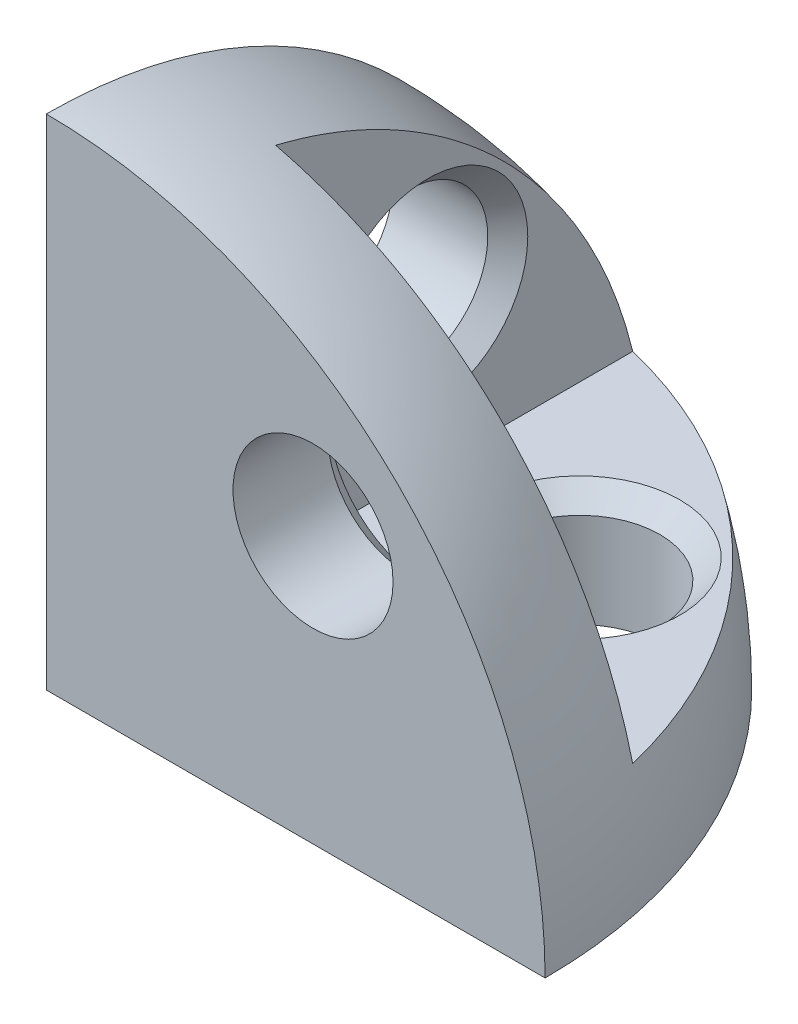
from build123d import *

# Parameters (mm, degrees)
REVOLVE_1_ANGLE     = 90
SHELL_3_T           = -4.3
SKETCH_1_3_R        = 3
CUT_EXTRUDE_2_DEPTH = 10
SKETCH_3_R          = 3
CUT_EXTRUDE_3_DEPTH = 10
SKETCH_4_R          = 3
CUT_EXTRUDE_4_DEPTH = 10
CHAMFER_1_SIZE      = 0.75


with BuildPart() as part:
    # 草图1 → 旋转1 (revolve)
    with BuildSketch(Plane.XY):
        with BuildLine():
            Line((0, 18.7), (0, 0))
            Line((0, 0), (18.7, 0))
            ThreePointArc((18.7, 0), (13.222896808, 13.222896808), (0, 18.7))
        make_face()
    revolve(axis=Axis((0, 0, 0), (0, 1, 0)), revolution_arc=REVOLVE_1_ANGLE)

    # 抽壳3
    shell_3_openings = [part.faces().sort_by_distance(p)[0] for p in [
        (9.35, 13.222896808, -9.35),
    ]]
    offset(amount=SHELL_3_T, openings=shell_3_openings, kind=Kind.INTERSECTION)

    # 草图1<3> → 切除-拉伸2 (cut)
    with BuildSketch(Plane.XY):
        with Locations((10, 10)):
            Circle(SKETCH_1_3_R)
    extrude(amount=-CUT_EXTRUDE_2_DEPTH, mode=Mode.SUBTRACT)

    # 草图3 → 切除-拉伸3 (cut)
    with BuildSketch(Plane.XZ):
        with Locations((10, -10)):
            Circle(SKETCH_3_R)
    extrude(amount=-CUT_EXTRUDE_3_DEPTH, mode=Mode.SUBTRACT)

    # 草图4 → 切除-拉伸4 (cut)
    with BuildSketch(Plane.ZY):
        with Locations((-10, 10)):
            Circle(SKETCH_4_R)
    extrude(amount=-CUT_EXTRUDE_4_DEPTH, mode=Mode.SUBTRACT)

    # 倒角1
    chamfer_1_edges = [part.edges().sort_by_distance(p)[0] for p in [
        (7, 10, -4.3),
        (7, 4.3, -10),
        (4.3, 10, -13),
    ]]
    chamfer(chamfer_1_edges, length=CHAMFER_1_SIZE)


solid = part.part
